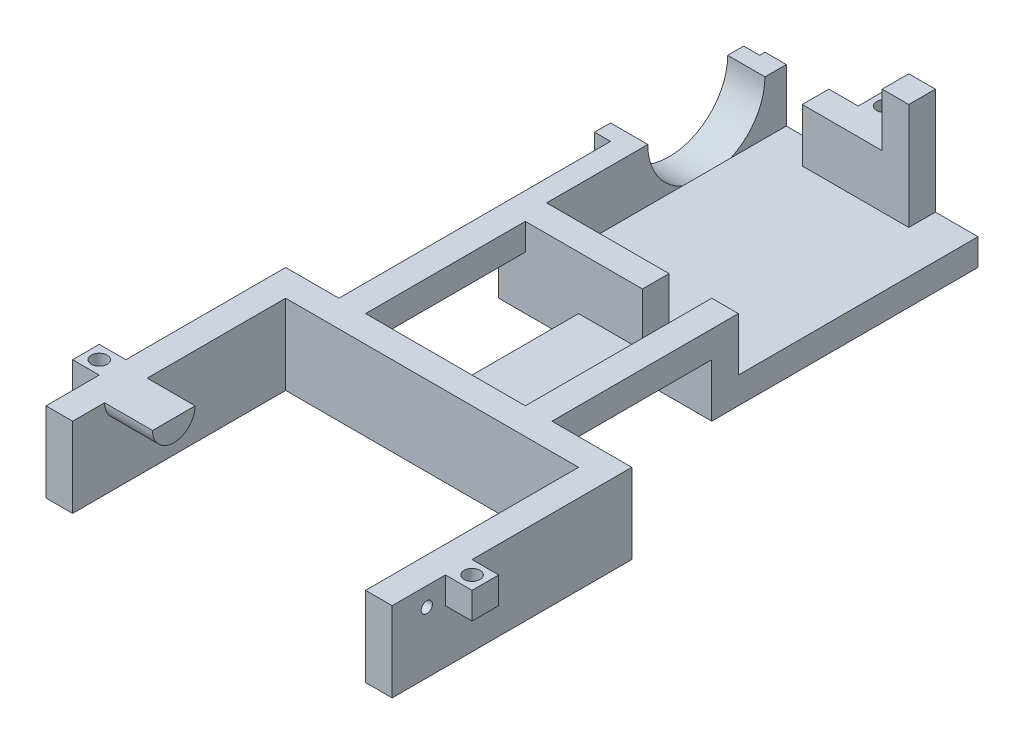
from build123d import *

# Parameters (mm, degrees)
SKETCH1_W            = 40
SKETCH1_H            = 50
BOSS_EXTRUDE1_DEPTH  = 5
SKETCH3_W            = 5
SKETCH3_H            = 5
BOSS_EXTRUDE5_DEPTH  = 20
SKETCH3_3_W          = 15
SKETCH3_3_H          = 5
SKETCH3_3_W_2        = 5
BOSS_EXTRUDE6_DEPTH  = 10
CUT_EXTRUDE3_DEPTH   = 4
BOSS_EXTRUDE9_START  = 3
BOSS_EXTRUDE9_DEPTH  = 3
SKETCH11_W           = 5
SKETCH11_H           = 5
BOSS_EXTRUDE10_DEPTH = 5
SKETCH12_R           = 1.5
CUT_EXTRUDE4_DEPTH   = 5
SKETCH14_W           = 5
SKETCH14_H           = 5
SKETCH14_W_2         = 10
BOSS_EXTRUDE12_DEPTH = 30
SKETCH15_W           = 40
SKETCH15_H           = 15
BOSS_EXTRUDE13_DEPTH = 5
BOSS_EXTRUDE15_DEPTH = 15
BOSS_EXTRUDE17_DEPTH = 10
SKETCH18_W           = 5
SKETCH18_H           = 15
BOSS_EXTRUDE18_DEPTH = 40
BOSS_EXTRUDE19_DEPTH = 9
SKETCH20_W           = 5
SKETCH20_H           = 5
BOSS_EXTRUDE20_DEPTH = 5
SKETCH21_R           = 1.5
CUT_EXTRUDE5_DEPTH   = 5
SKETCH22_W           = 5
SKETCH22_H           = 5
BOSS_EXTRUDE21_DEPTH = 5
SKETCH23_R           = 1.5
CUT_EXTRUDE6_DEPTH   = 5
SKETCH24_R           = 1.05
CUT_EXTRUDE7_DEPTH   = 5


with BuildPart() as part:
    # Sketch1 → Boss-Extrude1 (new body)
    with BuildSketch(Plane(origin=(0, 0, 0), x_dir=(1, 0, 0), z_dir=(0, 1, 0))):
        Rectangle(SKETCH1_W, SKETCH1_H)
    extrude(amount=BOSS_EXTRUDE1_DEPTH)

    # Sketch3 → Boss-Extrude5 (add)
    with BuildSketch(Plane(origin=(0, 5, 0), x_dir=(1, 0, 0), z_dir=(0, 1, 0))):
        with Locations((9.5, 22.5)):
            Rectangle(SKETCH3_W, SKETCH3_H)
    extrude(amount=BOSS_EXTRUDE5_DEPTH)

    # Sketch3<3> → Boss-Extrude6 (add)
    with BuildSketch(Plane(origin=(0, 5, 0), x_dir=(1, 0, 0), z_dir=(0, 1, 0))):
        with Locations((-0.5, 22.5)):
            Rectangle(SKETCH3_3_W, SKETCH3_3_H)
        with Locations((17.5, -22.5)):
            Rectangle(SKETCH3_3_W_2, SKETCH3_3_H)
        Polygon((-16, -20), (-16, 25), (-20, 25), (-20, -25), (7, -25), (7, -20), align=None)
    extrude(amount=BOSS_EXTRUDE6_DEPTH)

    # Sketch8 → Cut-Extrude3 (cut)
    with BuildSketch(Plane.ZY.offset(20)):
        with BuildLine():
            Line((1, 15), (-21, 15))
            ThreePointArc((-21, 15), (-10, 4), (1, 15))
        make_face()
    extrude(amount=-CUT_EXTRUDE3_DEPTH, mode=Mode.SUBTRACT)

    # Sketch10 → Boss-Extrude9 (add)
    with BuildSketch(Plane.ZY.offset(20).offset(BOSS_EXTRUDE9_START)):
        with BuildLine():
            Line((1, 15), (4, 15))
            Line((4, 15), (4, 0))
            Line((4, 0), (-24, 0))
            Line((-24, 0), (-24, 15))
            Line((-24, 15), (-21, 15))
            ThreePointArc((-21, 15), (-10, 4), (1, 15))
        make_face()
    extrude(amount=-BOSS_EXTRUDE9_DEPTH)

    # Sketch11 → Boss-Extrude10 (add)
    with BuildSketch(Plane(origin=(0, 0, -25), x_dir=(-1, 0, 0), z_dir=(0, 0, -1))):
        with Locations((0, 12.5)):
            Rectangle(SKETCH11_W, SKETCH11_H)
    extrude(amount=BOSS_EXTRUDE10_DEPTH)

    # Sketch12 → Cut-Extrude4 (cut)
    with BuildSketch(Plane.XZ.offset(-10)):
        with Locations((0, -27.5)):
            Circle(SKETCH12_R)
    extrude(amount=-CUT_EXTRUDE4_DEPTH, mode=Mode.SUBTRACT)

    # Sketch14 → Boss-Extrude12 (add)
    with BuildSketch(Plane.XY.offset(25)):
        with Locations((17.5, 12.5)):
            Rectangle(SKETCH14_W, SKETCH14_H)
        with Locations((-17.5, 12.5)):
            Rectangle(SKETCH14_W, SKETCH14_H)
        with Locations((0, 2.5)):
            Rectangle(SKETCH14_W_2, SKETCH14_H)
    extrude(amount=BOSS_EXTRUDE12_DEPTH)

    # Sketch15 → Boss-Extrude13 (add)
    with BuildSketch(Plane.XY.offset(55)):
        with Locations((0, 7.5)):
            Rectangle(SKETCH15_W, SKETCH15_H)
    extrude(amount=BOSS_EXTRUDE13_DEPTH)

    # Sketch16 → Boss-Extrude15 (add)
    with BuildSketch(Plane(origin=(20, 0, 0), x_dir=(0, 0, -1), z_dir=(1, 0, 0))):
        Polygon((-60, 0), (-55, 0), (-55, 10), (-55, 15), (-60, 15), align=None)
    extrude(amount=BOSS_EXTRUDE15_DEPTH)

    # Sketch17 → Boss-Extrude17 (add)
    with BuildSketch(Plane.ZY.offset(20)):
        Polygon((55, 0), (60, 0), (60, 15), (55, 15), (55, 10), align=None)
    extrude(amount=BOSS_EXTRUDE17_DEPTH)

    # Sketch18 → Boss-Extrude18 (add)
    with BuildSketch(Plane.XY.offset(60)):
        with Locations((32.5, 7.5)):
            Rectangle(SKETCH18_W, SKETCH18_H)
        with Locations((-27.5, 7.5)):
            Rectangle(SKETCH18_W, SKETCH18_H)
    extrude(amount=BOSS_EXTRUDE18_DEPTH)

    # Sketch19 → Boss-Extrude19 (add)
    with BuildSketch(Plane(origin=(-25, 0, 0), x_dir=(0, 0, -1), z_dir=(1, 0, 0))):
        with BuildLine():
            Line((-86, 15), (-94, 15))
            ThreePointArc((-94, 15), (-90, 11), (-86, 15))
        make_face()
    extrude(amount=BOSS_EXTRUDE19_DEPTH)

    # Sketch20 → Boss-Extrude20 (add)
    with BuildSketch(Plane.ZY.offset(30)):
        with Locations((87.5, 12.5)):
            Rectangle(SKETCH20_W, SKETCH20_H)
    extrude(amount=BOSS_EXTRUDE20_DEPTH)

    # Sketch21 → Cut-Extrude5 (cut)
    with BuildSketch(Plane.XZ.offset(-10)):
        with Locations((-32.5, 87.5)):
            Circle(SKETCH21_R)
    extrude(amount=-CUT_EXTRUDE5_DEPTH, mode=Mode.SUBTRACT)

    # Sketch22 → Boss-Extrude21 (add)
    with BuildSketch(Plane(origin=(35, 0, 0), x_dir=(0, 0, -1), z_dir=(1, 0, 0))):
        with Locations((-87.5, 12.5)):
            Rectangle(SKETCH22_W, SKETCH22_H)
    extrude(amount=BOSS_EXTRUDE21_DEPTH)

    # Sketch23 → Cut-Extrude6 (cut)
    with BuildSketch(Plane.XZ.offset(-10)):
        with Locations((37.5, 87.5)):
            Circle(SKETCH23_R)
    extrude(amount=-CUT_EXTRUDE6_DEPTH, mode=Mode.SUBTRACT)

    # Sketch24 → Cut-Extrude7 (cut)
    with BuildSketch(Plane.ZY.offset(-30)):
        with Locations((93.5, 11.5)):
            Circle(SKETCH24_R)
        with Locations((86.5, 11.5)):
            Circle(SKETCH24_R)
    extrude(amount=-CUT_EXTRUDE7_DEPTH, mode=Mode.SUBTRACT)


solid = part.part
